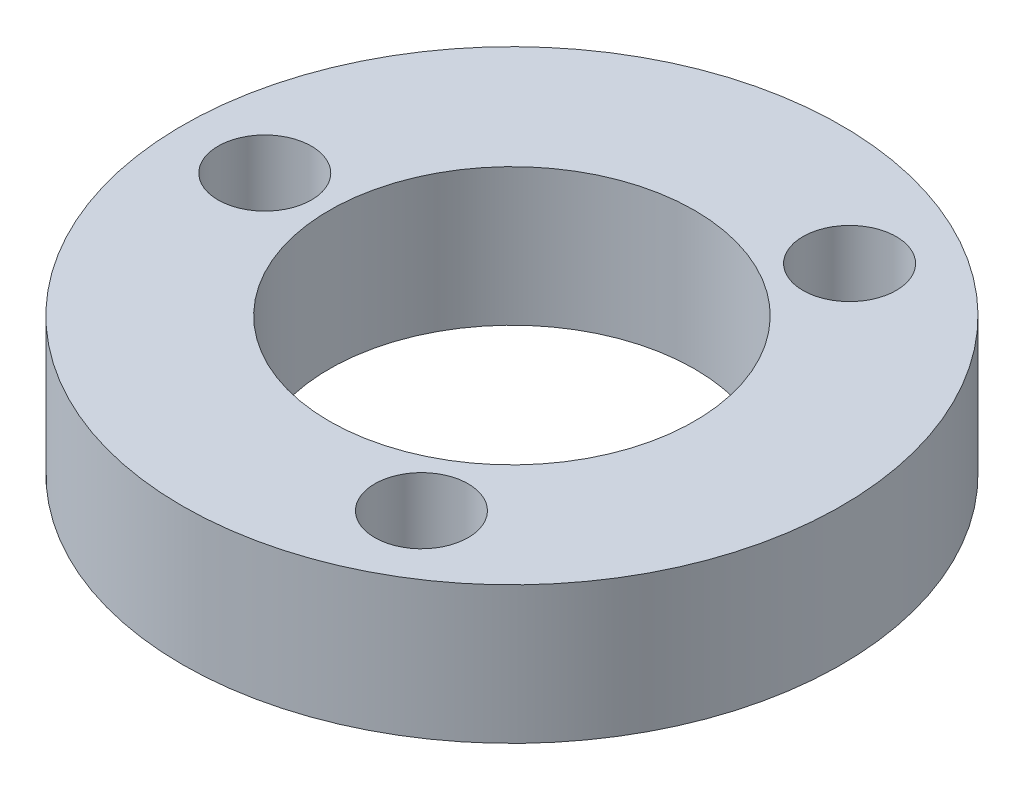
from build123d import *

# Parameters (mm, degrees)
SKETCH_1_R      = 12
SKETCH_1_R_2    = 6.65
SKETCH_1_R_3    = 1.7
EXTRUDE_1_DEPTH = 5


with BuildPart() as part:
    # Эскиз1 → Бобышка-Вытянуть1 (new body)
    with BuildSketch(Plane(origin=(0, 0, 0), x_dir=(1, 0, 0), z_dir=(0, 1, 0))):
        with Locations(Location((0, 0, 0), (0, 0, 270))):
            Circle(SKETCH_1_R)
        with Locations(Location((0, 0, 0), (0, 0, 270))):
            Circle(SKETCH_1_R_2, mode=Mode.SUBTRACT)
        with Locations(Location((-9, 0, 0), (0, 0, 270))):
            Circle(SKETCH_1_R_3, mode=Mode.SUBTRACT)
        with Locations(Location((4.5, 7.794228634, 0), (0, 0, 270))):
            Circle(SKETCH_1_R_3, mode=Mode.SUBTRACT)
        with Locations(Location((4.5, -7.794228634, 0), (0, 0, 270))):
            Circle(SKETCH_1_R_3, mode=Mode.SUBTRACT)
    extrude(amount=EXTRUDE_1_DEPTH)


solid = part.part
